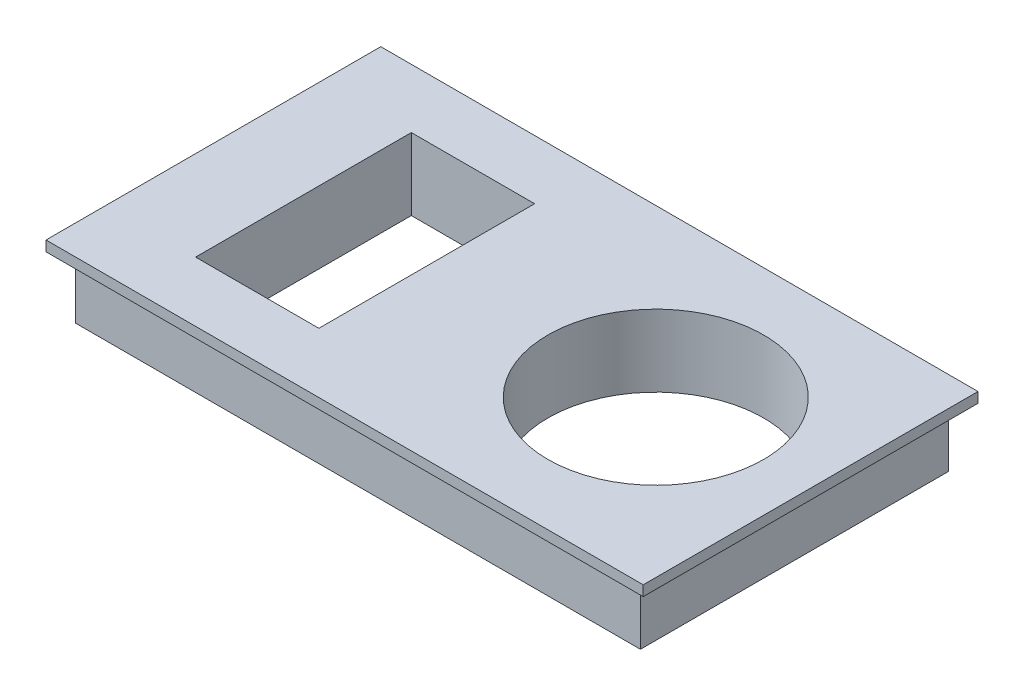
from build123d import *

# Parameters (mm, degrees)
SKETCH1_W           = 55
SKETCH1_H           = 30
SKETCH1_W_2         = 12
SKETCH1_H_2         = 21
SKETCH1_R           = 10.5
BOSS_EXTRUDE1_DEPTH = 7
SKETCH1_3_W         = 58.132008701
SKETCH1_3_H         = 32.587347793
SKETCH1_3_W_2       = 55
SKETCH1_3_H_2       = 30
BOSS_EXTRUDE2_DEPTH = 1


with BuildPart() as part:
    # Sketch1 → Boss-Extrude1 (new body)
    with BuildSketch(Plane(origin=(0, 0, 0), x_dir=(1, 0, 0), z_dir=(0, 1, 0))):
        Rectangle(SKETCH1_W, SKETCH1_H)
        with Locations((-14.212711625, -0.088861689)):
            Rectangle(SKETCH1_W_2, SKETCH1_H_2, mode=Mode.SUBTRACT)
        with Locations((13.99341574, 0)):
            Circle(SKETCH1_R, mode=Mode.SUBTRACT)
    extrude(amount=-BOSS_EXTRUDE1_DEPTH)

    # Sketch1<3> → Boss-Extrude2 (add)
    with BuildSketch(Plane(origin=(0, 0, 0), x_dir=(1, 0, 0), z_dir=(0, 1, 0))):
        with Locations((0.128352579, -0.130903876)):
            Rectangle(SKETCH1_3_W, SKETCH1_3_H)
        Rectangle(SKETCH1_3_W_2, SKETCH1_3_H_2, mode=Mode.SUBTRACT)
    extrude(amount=-BOSS_EXTRUDE2_DEPTH)


solid = part.part
